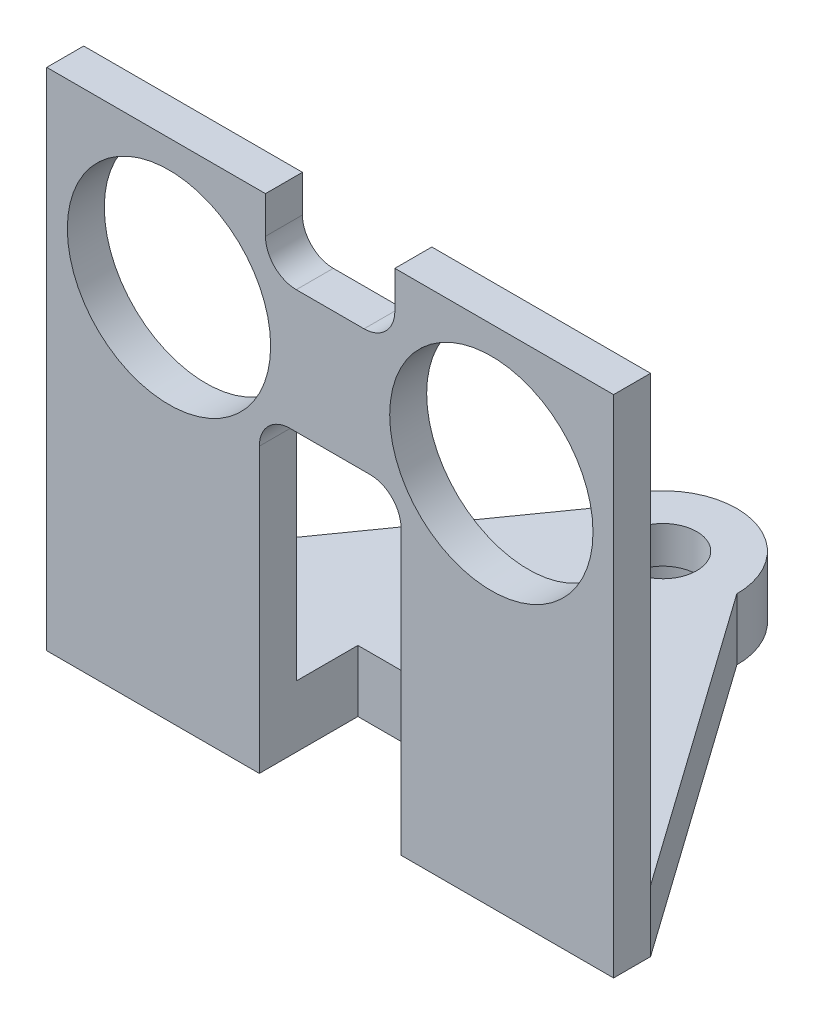
from build123d import *

# Parameters (mm, degrees)
SKETCH1_R           = 8.25
BOSS_EXTRUDE1_DEPTH = 3
SKETCH2_W           = 17.25
SKETCH2_H           = 3
BOSS_EXTRUDE2_DEPTH = 5
BOSS_EXTRUDE3_DEPTH = 3
SKETCH4_R           = 2.75
SKETCH4_R_2         = 0.6
CUT_EXTRUDE1_DEPTH  = 55.313902456


with BuildPart() as part:
    # Sketch1 → Boss-Extrude1 (new body)
    # profile 1 of 2: a face of its own
    with BuildSketch(Plane.XY):
        with BuildLine():
            Line((-3.25, 0), (0, 0))
            Line((0, 0), (0, 10))
            Line((0, 10), (-2.75, 10))
            ThreePointArc((-2.75, 10), (-4.517766953, 10.732233047), (-5.25, 12.5))
            Line((-5.25, 12.5), (-5.25, 15.5))
            Line((-5.25, 15.5), (-23, 15.5))
            Line((-23, 15.5), (-23, -20.5))
            Line((-23, -20.5), (-5.75, -20.5))
            Line((-5.75, -20.5), (-5.75, -2.5))
            ThreePointArc((-5.75, -2.5), (-5.017766953, -0.732233047), (-3.25, 0))
        make_face()
        with Locations((-13.08, 5)):
            Circle(SKETCH1_R, mode=Mode.SUBTRACT)
    # profile 2 of 2: a face of its own
    with BuildSketch(Plane.XY):
        with BuildLine():
            Line((0, 10), (0, 0))
            Line((0, 0), (3.25, 0))
            ThreePointArc((3.25, 0), (5.017766953, -0.732233047), (5.75, -2.5))
            Line((5.75, -2.5), (5.75, -20.5))
            Line((5.75, -20.5), (23, -20.5))
            Line((23, -20.5), (23, 15.5))
            Line((23, 15.5), (5.25, 15.5))
            Line((5.25, 15.5), (5.25, 12.5))
            ThreePointArc((5.25, 12.5), (4.517766953, 10.732233047), (2.75, 10))
            Line((2.75, 10), (0, 10))
        make_face()
        with Locations((13.08, 5)):
            Circle(SKETCH1_R, mode=Mode.SUBTRACT)
    extrude(amount=BOSS_EXTRUDE1_DEPTH)

    # Sketch2 → Boss-Extrude2 (add)
    # profile 1 of 2: a face of its own
    with BuildSketch(Plane.XZ.offset(20.5)):
        with BuildLine():
            Line((-23, 3), (-23, 0))
            Line((-23, 0), (-6, -24))
            ThreePointArc((-6, -24), (0, -30), (6, -24))
            Line((6, -24), (23, 0))
            Line((23, 0), (5.75, 0))
            Line((5.75, 0), (5.75, -5))
            Line((5.75, -5), (-5.75, -5))
            Line((-5.75, -5), (-5.75, 3))
            Line((-5.75, 3), (-23, 3))
        make_face()
        with BuildLine():
            Line((-3.449357744, -23.406762144), (-2.1, -7.6))
            ThreePointArc((-2.1, -7.6), (0, -5.5), (2.1, -7.6))
            Line((2.1, -7.6), (3.449357744, -23.406762144))
            ThreePointArc((3.449357744, -23.406762144), (3.487316454, -23.702302254), (3.5, -24))
            ThreePointArc((3.5, -24), (0, -27.5), (-3.5, -24))
            ThreePointArc((-3.5, -24), (-3.487316454, -23.702302254), (-3.449357744, -23.406762144))
        make_face(mode=Mode.SUBTRACT)
    # profile 2 of 2: a face of its own
    with BuildSketch(Plane.XZ.offset(20.5)):
        with Locations((14.375, 1.5)):
            Rectangle(SKETCH2_W, SKETCH2_H)
    extrude(amount=BOSS_EXTRUDE2_DEPTH)

    # Sketch3 → Boss-Extrude3 (add)
    with BuildSketch(Plane(origin=(0, -20.5, 0), x_dir=(1, 0, 0), z_dir=(0, 1, 0))):
        with BuildLine():
            Line((2.1, 7.6), (3.449357744, 23.406762144))
            ThreePointArc((3.449357744, 23.406762144), (0, 27.5), (-3.449357744, 23.406762144))
            Line((-3.449357744, 23.406762144), (-2.1, 7.6))
            ThreePointArc((-2.1, 7.6), (0, 5.5), (2.1, 7.6))
        make_face()
    extrude(amount=-BOSS_EXTRUDE3_DEPTH)

    # Sketch4 → Cut-Extrude1 (cut, through all)
    with BuildSketch(Plane.XZ.offset(23.5)):
        with Locations(Location((0, -24, 0), (0, 0, 270))):
            Circle(SKETCH4_R)
        with Locations(Location((0, -19.5, 0), (0, 0, 270))):
            Circle(SKETCH4_R_2)
        with Locations(Location((0, -16, 0), (0, 0, 270))):
            Circle(SKETCH4_R_2)
        with Locations(Location((0, -12.5, 0), (0, 0, 270))):
            Circle(SKETCH4_R_2)
        with Locations(Location((0, -9, 0), (0, 0, 270))):
            Circle(SKETCH4_R_2)
    extrude(amount=-CUT_EXTRUDE1_DEPTH, mode=Mode.SUBTRACT)


solid = part.part
